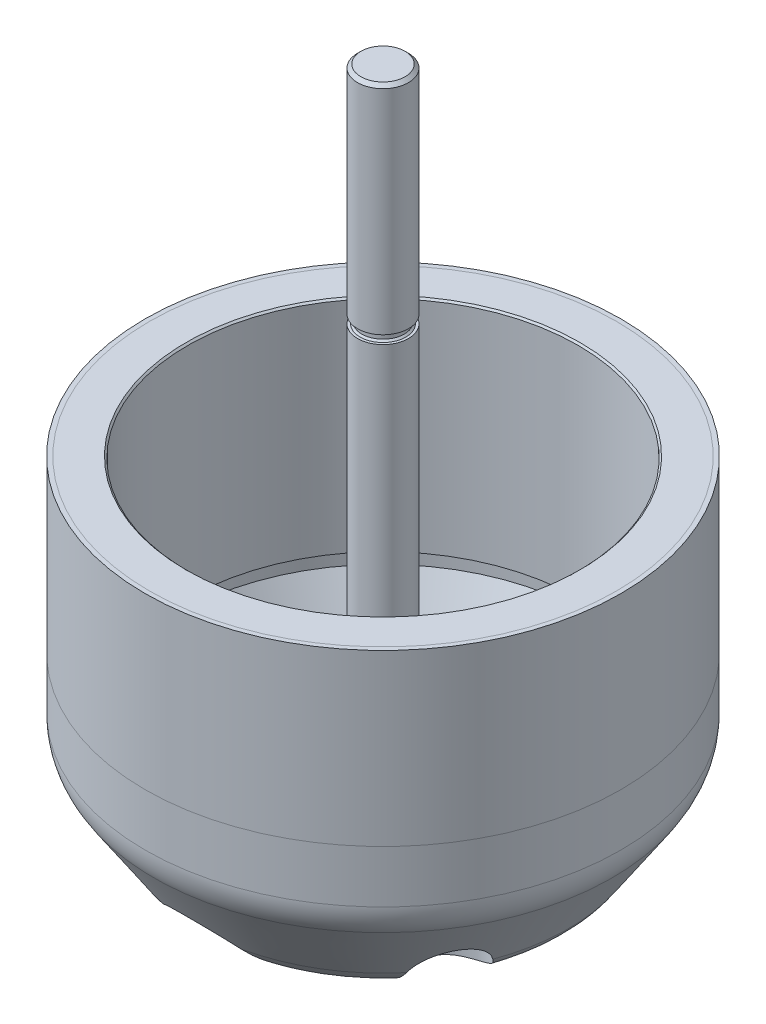
from build123d import *

# Parameters (mm, degrees)
SKETCH2_R           = 3.5
SKETCH2_R_2         = 1
SKETCH2_R_3         = 2
CUT_EXTRUDE1_DEPTH  = 3.5
SKETCH3_W           = 0.26
SKETCH3_H           = 10
SKETCH4_R           = 1.5
BOSS_EXTRUDE1_DEPTH = 42
CHAMFER1_SIZE       = 0.2


with BuildPart() as part:
    # Sketch1 → Revolve1 (revolve)
    with BuildSketch(Plane.XY, mode=Mode.PRIVATE) as revolve1_sk:
        with BuildLine():
            Line((10.890599608, 1.335899411), (13.496150883, 5.244226325))
            ThreePointArc((13.496150883, 5.244226325), (13.871276079, 6.038974467), (14, 6.908326913))
            Line((14, 6.908326913), (14, 10))
            Line((14, 10), (13.75, 10))
            Line((13.75, 10), (13.75, 20))
            Line((13.75, 20), (11.6, 20))
            Line((11.6, 20), (11.5, 19.9))
            Line((11.5, 19.9), (11.5, 7))
            Line((11.5, 7), (12, 7))
            Line((12, 7), (12, 6))
            Line((12, 6), (10.829179607, 3.658359214))
            ThreePointArc((10.829179607, 3.658359214), (9.72309137, 2.448047575), (8.145898034, 2))
            Line((8.145898034, 2), (4.5, 2))
            Line((4.5, 2), (3.478316402, 4.5))
            Line((3.478316402, 4.5), (1.6, 4.5))
            Line((1.6, 4.5), (1.5, 4.4))
            Line((1.5, 4.4), (1.5, -1.9))
            Line((1.5, -1.9), (1.6, -2))
            Line((1.6, -2), (4.4, -2))
            Line((4.4, -2), (4.5, -1.9))
            Line((4.5, -1.9), (4.5, 0))
            Line((4.5, 0), (8.394448725, 0))
            ThreePointArc((8.394448725, 0), (9.810022501, 0.354976204), (10.890599608, 1.335899411))
        make_face()
    revolve(revolve1_sk.sketch.rotate(Axis((0, -5, 0), (0, 1, 0)), 90), axis=Axis((0, -5, 0), (0, 1, 0)))

    # Sketch2 → Cut-Extrude1 (cut)
    with BuildSketch(Plane.XZ):
        with Locations(Location((0, 8, 0), (0, 0, 270))):
            Circle(SKETCH2_R)
        with Locations(Location((5.196152423, 3, 0), (0, 0, 270))):
            Circle(SKETCH2_R_2)
        with Locations(Location((8.660254038, 5, 0), (0, 0, 243.035729931))):
            Circle(SKETCH2_R_3)
        with Locations(Location((6.92820323, -4, 0), (0, 0, 150))):
            Circle(SKETCH2_R)
        with Locations(Location((0, -10, 0), (0, 0, 201.415521877))):
            Circle(SKETCH2_R_3)
        with Locations(Location((0, -6, 0), (0, 0, 270))):
            Circle(SKETCH2_R_2)
        with Locations(Location((-6.92820323, -4, 0), (0, 0, 30))):
            Circle(SKETCH2_R)
        with Locations(Location((-8.660254038, 5, 0), (0, 0, 296.964270066))):
            Circle(SKETCH2_R_3)
        with Locations(Location((-5.196152423, 3, 0), (0, 0, 270))):
            Circle(SKETCH2_R_2)
    extrude(amount=-CUT_EXTRUDE1_DEPTH, mode=Mode.SUBTRACT)


with BuildPart() as body_2:
    # Sketch3 → Revolve2 (revolve)
    with BuildSketch(Plane.XY, mode=Mode.PRIVATE) as revolve2_sk:
        with Locations((13.88, 15)):
            Rectangle(SKETCH3_W, SKETCH3_H)
    revolve(revolve2_sk.sketch.rotate(Axis((0, -4, 0), (0, 1, 0)), 90), axis=Axis((0, -4, 0), (0, 1, 0)))


with BuildPart() as body_3:
    # Sketch4 → Boss-Extrude1 (new body)
    with BuildSketch(Plane.XZ.offset(2)):
        with Locations(Location((0, 0, 0), (0, 0, 270))):
            Circle(SKETCH4_R)
    extrude(amount=-BOSS_EXTRUDE1_DEPTH)

    # Chamfer1
    chamfer1_edges = [body_3.edges().sort_by_distance(p)[0] for p in [
        (0, -2, 1.5),
        (0, 40, 1.5),
    ]]
    chamfer(chamfer1_edges, length=CHAMFER1_SIZE)

    # Sketch5 → Cut-Revolve1 (revolve, cut)
    with BuildSketch(Plane.XY, mode=Mode.PRIVATE) as cut_revolve1_sk:
        Polygon((1.5, 27.25), (1.35, 27.25), (1.25, 27.15), (1.25, 26.85), (1.35, 26.75), (1.5, 26.75), align=None)
    revolve(cut_revolve1_sk.sketch.rotate(Axis((0, 43, 0), (0, -1, 0)), 77.863705485), axis=Axis((0, 43, 0), (0, -1, 0)), mode=Mode.SUBTRACT)


solid = Compound([part.part, body_2.part, body_3.part])
